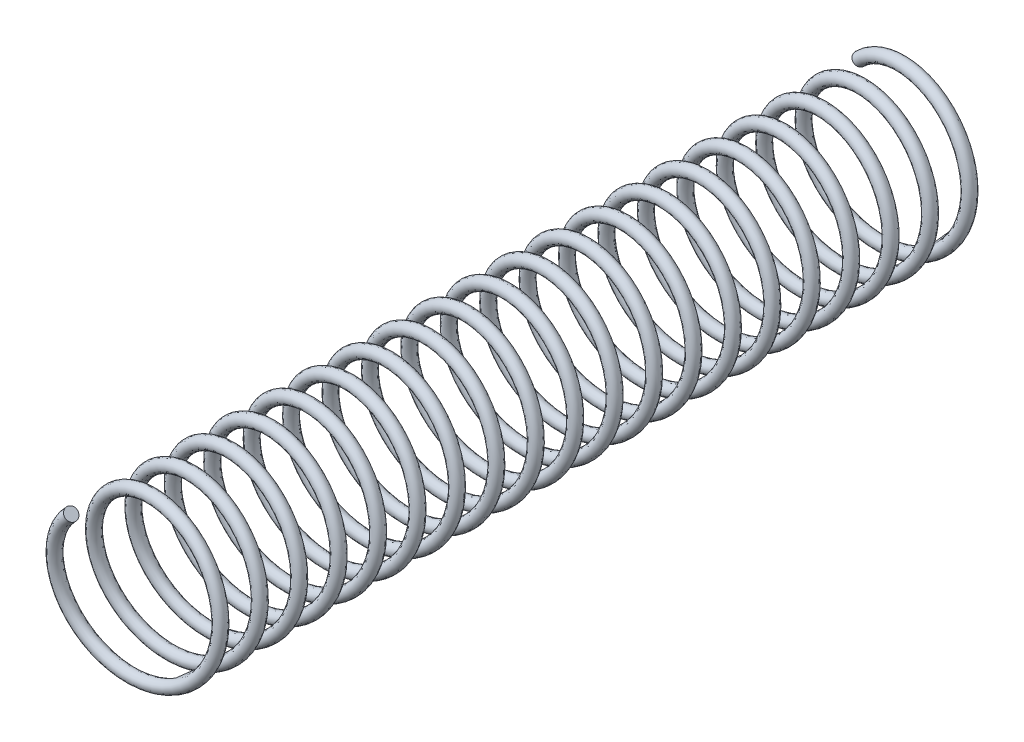
from build123d import *

# Parameters (mm, degrees)
SWEEP1_PITCH       = 4.1275
SWEEP1_HEIGHT      = 82.55
SWEEP1_RADIUS      = 7.62
SWEEP1_START_ANGLE = 135
SKETCH2_R          = 0.635


with BuildPart() as part:
    # Sweep1: sweep along a helix
    with BuildLine() as sweep1_path:
        add(Helix(SWEEP1_PITCH, SWEEP1_HEIGHT, SWEEP1_RADIUS, center=(0, 0, 0), direction=(0, 0, 1), lefthand=True, mode=Mode.PRIVATE).rotate(Axis((0, 0, 0), (0, 0, 1)), SWEEP1_START_ANGLE))
    # Sketch2 → Sweep1 (sweep)
    with BuildSketch(Plane(origin=(-5.388153673, 5.388153673, 82.55), x_dir=(0.060733649402492075, 0.06073364940248476, -0.9963045958242447), z_dir=(0.704493735834839, 0.7044937358344527, 0.08589035067741174))):
        Circle(SKETCH2_R)
    sweep(path=sweep1_path.line, is_frenet=True)


solid = part.part
